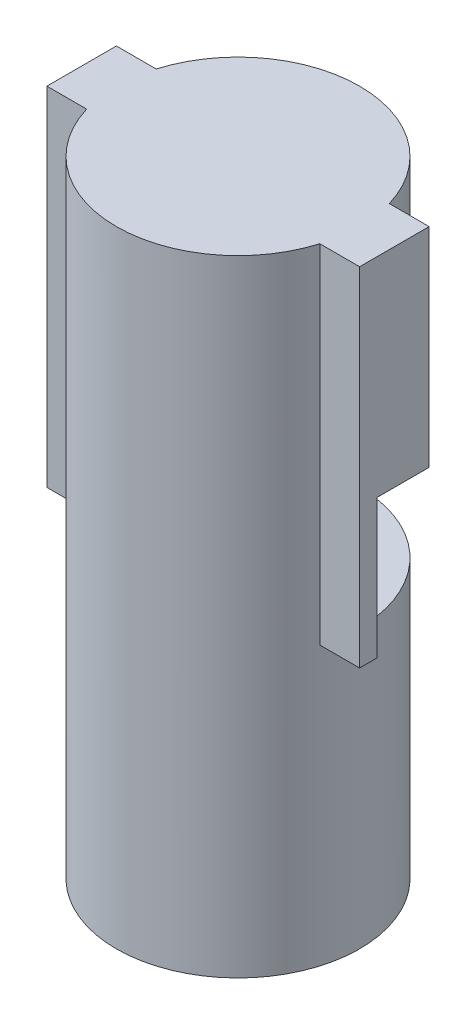
from build123d import *

# Parameters (mm, degrees)
SKETCH1_R           = 3.5
BOSS_EXTRUDE1_DEPTH = 18
SKETCH2_W           = 9
SKETCH2_H           = 2
BOSS_EXTRUDE3_DEPTH = 10
CUT_EXTRUDE3_START  = -8
SKETCH3_W           = 10
SKETCH3_H           = 4
CUT_EXTRUDE3_DEPTH  = 4


with BuildPart() as part:
    # Sketch1 → Boss-Extrude1 (new body)
    with BuildSketch(Plane(origin=(0, 0, 0), x_dir=(1, 0, 0), z_dir=(0, 1, 0))):
        with Locations(Location((0, 0, 0), (0, 0, 270))):
            Circle(SKETCH1_R)
    extrude(amount=BOSS_EXTRUDE1_DEPTH)

    # Sketch2 → Boss-Extrude3 (add)
    with BuildSketch(Plane(origin=(0, 18, 0), x_dir=(1, 0, 0), z_dir=(0, 1, 0))):
        Rectangle(SKETCH2_W, SKETCH2_H)
    extrude(amount=-BOSS_EXTRUDE3_DEPTH)

    # Sketch3 → Cut-Extrude3 (cut)
    with BuildSketch(Plane.XZ.offset(CUT_EXTRUDE3_START)):
        with Locations((0, -1.5)):
            Rectangle(SKETCH3_W, SKETCH3_H)
    extrude(amount=-CUT_EXTRUDE3_DEPTH, mode=Mode.SUBTRACT)


solid = part.part
